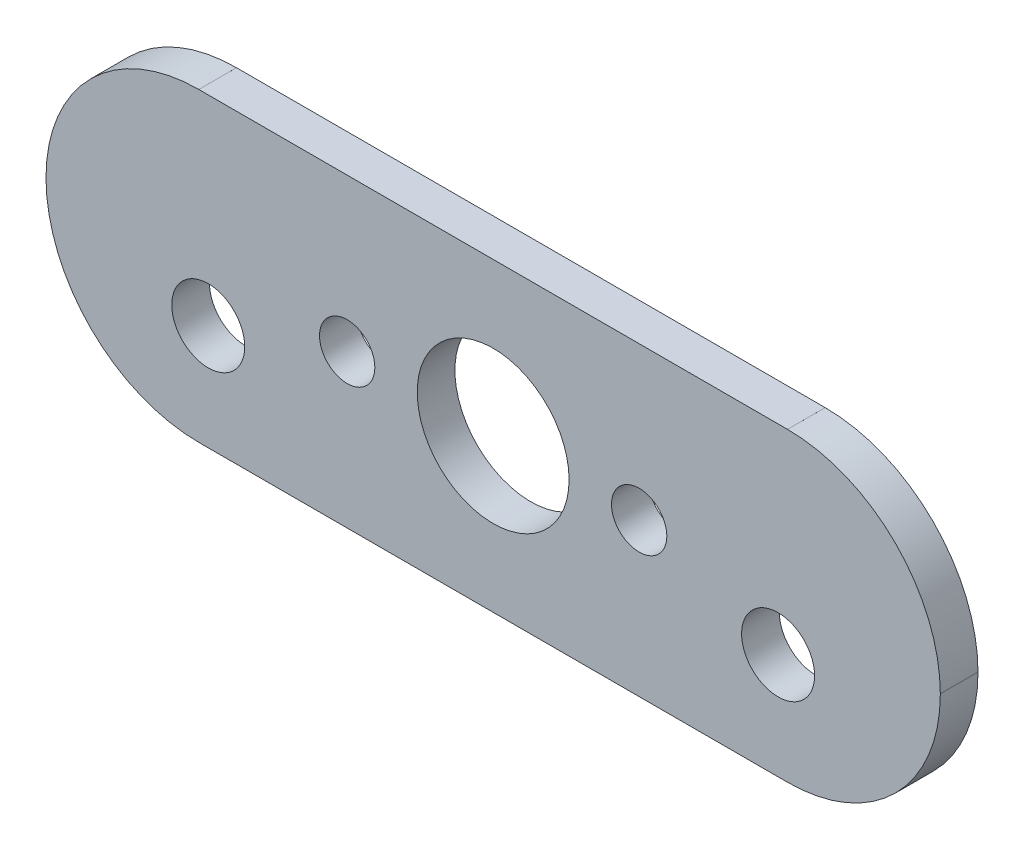
from build123d import *

# Parameters (mm, degrees)
MODEL_R                 = 1.55
MODEL_R_2               = 1.175
MODEL_R_3               = 3.225
SALIENTE_EXTRUIR1_DEPTH = 1.6


with BuildPart() as part:
    # Model → Saliente-Extruir1 (new body)
    with BuildSketch(Plane.XY):
        with BuildLine():
            Line((18.99, -0.000135429), (18.99, 0.019864571))
            ThreePointArc((18.99, 0.019864571), (17.082224275, 4.596089282), (12.5003, 6.490135416))
            ThreePointArc((12.5003, 6.490135429), (12.5, 6.489835429), (12.4997, 6.490135429))
            Line((12.4997, 6.490135429), (0, 6.490135429))
            Line((0, 6.490135429), (-12.4997, 6.490135429))
            ThreePointArc((-12.4997, 6.490135429), (-12.499999997, 6.489835429), (-12.5003, 6.490135422))
            ThreePointArc((-12.5003, 6.490135422), (-17.085798512, 4.592642615), (-18.990142559, 0.009985166))
            Line((-18.990142559, 0.009985166), (-18.990142559, -0.010014834))
            ThreePointArc((-18.990142559, -0.010014834), (-17.085798512, -4.592672284), (-12.5003, -6.490165091))
            ThreePointArc((-12.5003, -6.490165091), (-12.499999997, -6.489865098), (-12.4997, -6.490165098))
            Line((-12.4997, -6.490165098), (12.4997, -6.490135429))
            ThreePointArc((12.4997, -6.490135429), (12.5, -6.489835429), (12.5003, -6.490135429))
            ThreePointArc((12.5003, -6.490135415), (17.089185065, -4.589108362), (18.99, -0.000135429))
        make_face()
        with Locations((-12.1, -2)):
            Circle(MODEL_R, mode=Mode.SUBTRACT)
        with Locations((12.1, -2)):
            Circle(MODEL_R, mode=Mode.SUBTRACT)
        with Locations((-6.2, 0)):
            Circle(MODEL_R_2, mode=Mode.SUBTRACT)
        Circle(MODEL_R_3, mode=Mode.SUBTRACT)
        with Locations((6.2, 0)):
            Circle(MODEL_R_2, mode=Mode.SUBTRACT)
    extrude(amount=SALIENTE_EXTRUIR1_DEPTH)


solid = part.part
